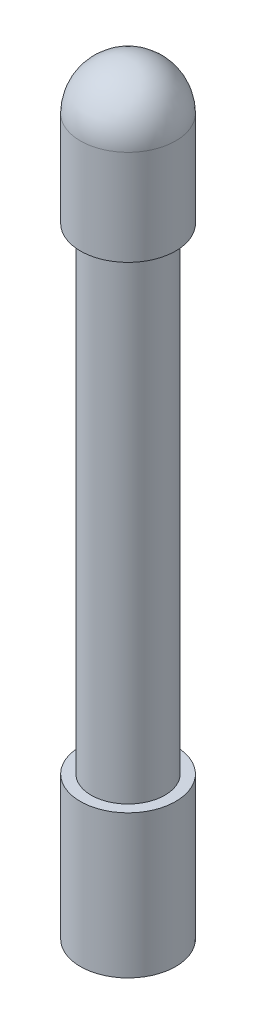
from build123d import *

# Parameters (mm, degrees)
SKETCH1_R           = 2.54
BOSS_EXTRUDE1_DEPTH = 7.62
SKETCH2_R           = 1.965028693
BOSS_EXTRUDE2_DEPTH = 25.4
SKETCH3_R           = 2.54
BOSS_EXTRUDE3_DEPTH = 7.62
FILLET1_R           = 2.54


with BuildPart() as part:
    # Sketch1 → Boss-Extrude1 (new body)
    with BuildSketch(Plane(origin=(0, 0, 0), x_dir=(1, 0, 0), z_dir=(0, 1, 0))):
        with Locations(Location((0, 0, 0), (0, 0, 90))):
            Circle(SKETCH1_R)
    extrude(amount=BOSS_EXTRUDE1_DEPTH)

    # Sketch2 → Boss-Extrude2 (add)
    with BuildSketch(Plane(origin=(0, 7.62, 0), x_dir=(1, 0, 0), z_dir=(0, 1, 0))):
        with Locations(Location((0, 0, 0), (0, 0, 270))):
            Circle(SKETCH2_R)
    extrude(amount=BOSS_EXTRUDE2_DEPTH)

    # Sketch3 → Boss-Extrude3 (add)
    with BuildSketch(Plane(origin=(0, 33.02, 0), x_dir=(1, 0, 0), z_dir=(0, 1, 0))):
        with Locations(Location((0, 0, 0), (0, 0, 90))):
            Circle(SKETCH3_R)
    extrude(amount=BOSS_EXTRUDE3_DEPTH)

    # Fillet1
    fillet1_edges = [part.edges().sort_by_distance(p)[0] for p in [
        (0, 40.64, 2.54),
    ]]
    fillet(fillet1_edges, radius=FILLET1_R)


solid = part.part
